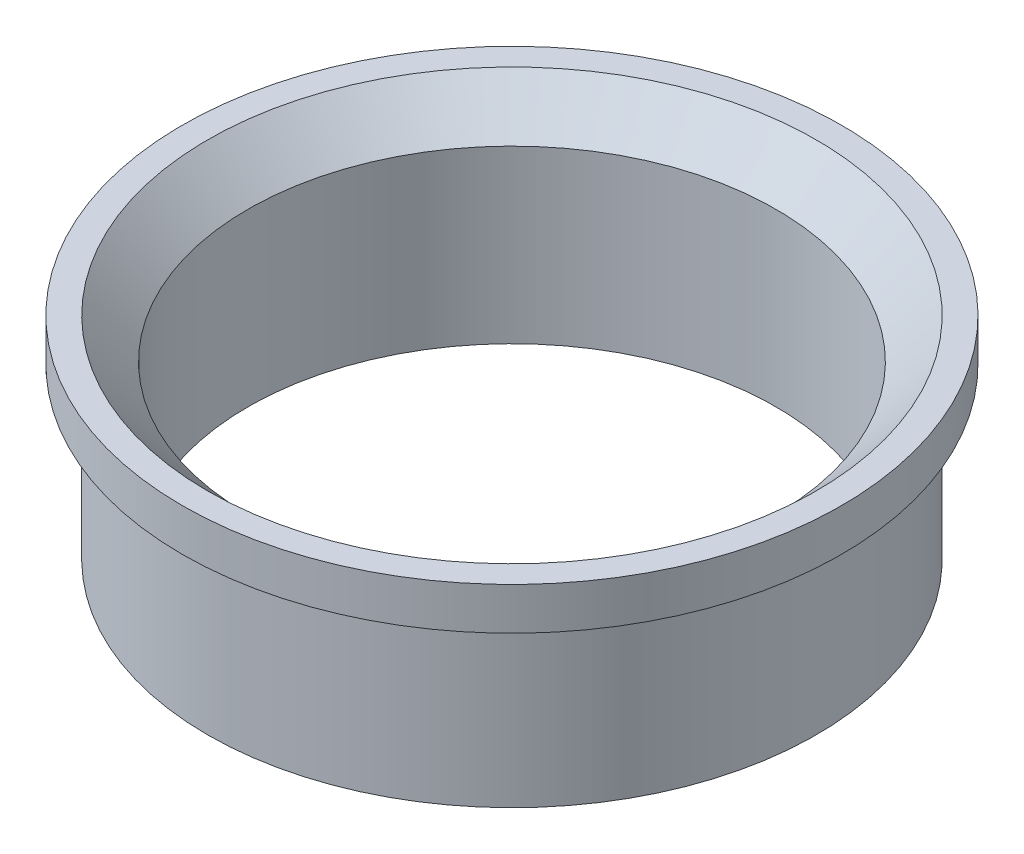
from build123d import *


with BuildPart() as part:
    # Sketch1 → Revolve1 (revolve)
    with BuildSketch(Plane.XY, mode=Mode.PRIVATE) as revolve1_sk:
        Polygon((-72, 40.137730956), (-78, 40.137730956), (-78, 30.137730956), (-72, 30.137730956), (-72, -9.862269044), (-62.5, -9.862269044), (-62.5, 30.637730956), align=None)
    revolve(revolve1_sk.sketch.rotate(Axis((0, 73.482922827, 0), (0, -1, 0)), 270), axis=Axis((0, 73.482922827, 0), (0, -1, 0)))


solid = part.part
